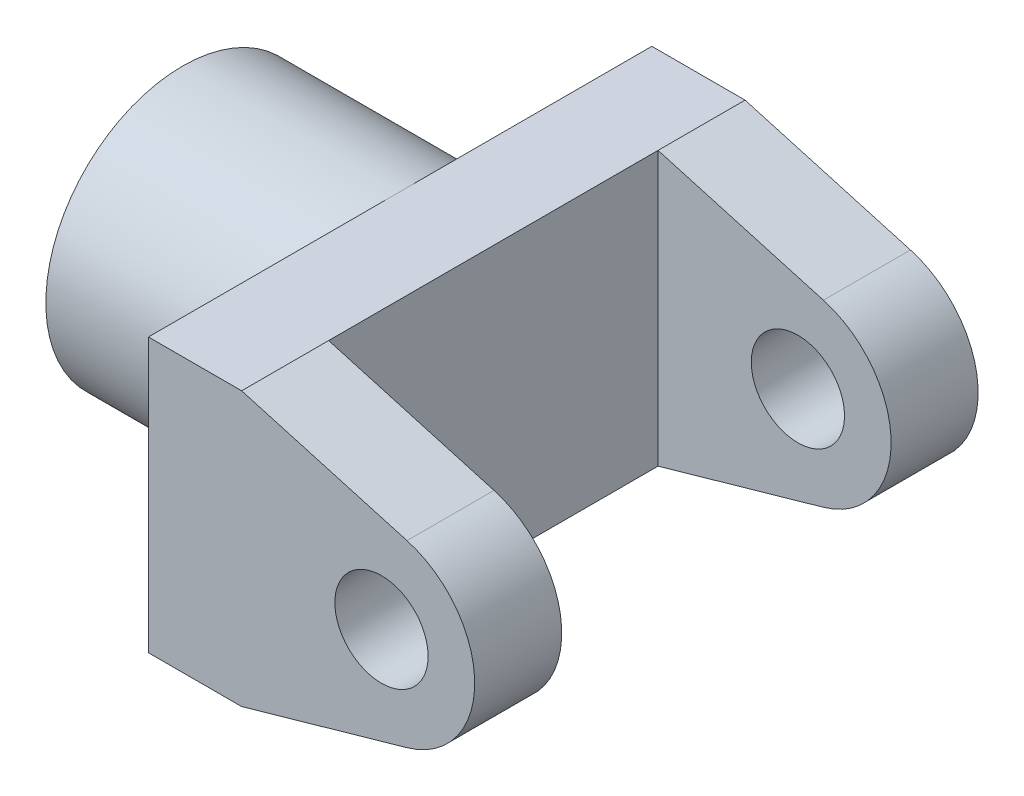
from build123d import *

# Parameters (mm, degrees)
SKETCH2_R           = 15
BOSS_EXTRUDE1_DEPTH = 162
SKETCH3_W           = 75
SKETCH3_H           = 106
CUT_EXTRUDE1_DEPTH  = 200.03014847
SKETCH4_R           = 44
SKETCH4_R_2         = 25
BOSS_EXTRUDE2_DEPTH = 70
CUT_EXTRUDE5_START  = -60
CUT_EXTRUDE5_DEPTH  = 60
SCALE1_SCALE        = 0.33


with BuildPart() as part:
    # Sketch2 → Boss-Extrude1 (new body)
    with BuildSketch(Plane.XY):
        with BuildLine():
            Line((-75, -44), (-45, -44))
            Line((-45, -44), (8.212754936, -28.853953912))
            ThreePointArc((8.212754936, -28.853953912), (30, 0), (8.212754936, 28.853953912))
            Line((8.212754936, 28.853953912), (-45, 44))
            Line((-45, 44), (-75, 44))
            Line((-75, 44), (-75, -44))
        make_face()
        Circle(SKETCH2_R, mode=Mode.SUBTRACT)
    extrude(amount=BOSS_EXTRUDE1_DEPTH)

    # Sketch3 → Cut-Extrude1 (cut, through all)
    with BuildSketch(Plane.XZ.offset(44)):
        with Locations((-7.5, 81)):
            Rectangle(SKETCH3_W, SKETCH3_H)
    extrude(amount=-CUT_EXTRUDE1_DEPTH, mode=Mode.SUBTRACT)

    # Sketch4 → Boss-Extrude2 (add)
    with BuildSketch(Plane.ZY.offset(75)):
        with Locations(Location((81, 0, 0), (0, 0, 270))):
            Circle(SKETCH4_R)
        with Locations(Location((81, 0, 0), (0, 0, 270))):
            Circle(SKETCH4_R_2, mode=Mode.SUBTRACT)
    extrude(amount=BOSS_EXTRUDE2_DEPTH)

    # Sketch7 → Cut-Extrude5 (cut)
    with BuildSketch(Plane.ZY.offset(145).offset(CUT_EXTRUDE5_START)):
        with BuildLine():
            Line((50.06906521, -4), (56.322074641, -4))
            ThreePointArc((56.322074641, -4), (56, 0), (56.322074641, 4))
            Line((56.322074641, 4), (50.06906521, 4))
            Line((50.06906521, 4), (50.06906521, -4))
        make_face()
    extrude(amount=CUT_EXTRUDE5_DEPTH, mode=Mode.SUBTRACT)


with BuildPart() as part_1:
    # Scale1: scaled about (-64.229382242, 0, 81.085826585)
    add(part.part.scale(SCALE1_SCALE).moved(Location((-43.033686102, 0, 54.327503812))))


solid = part_1.part
